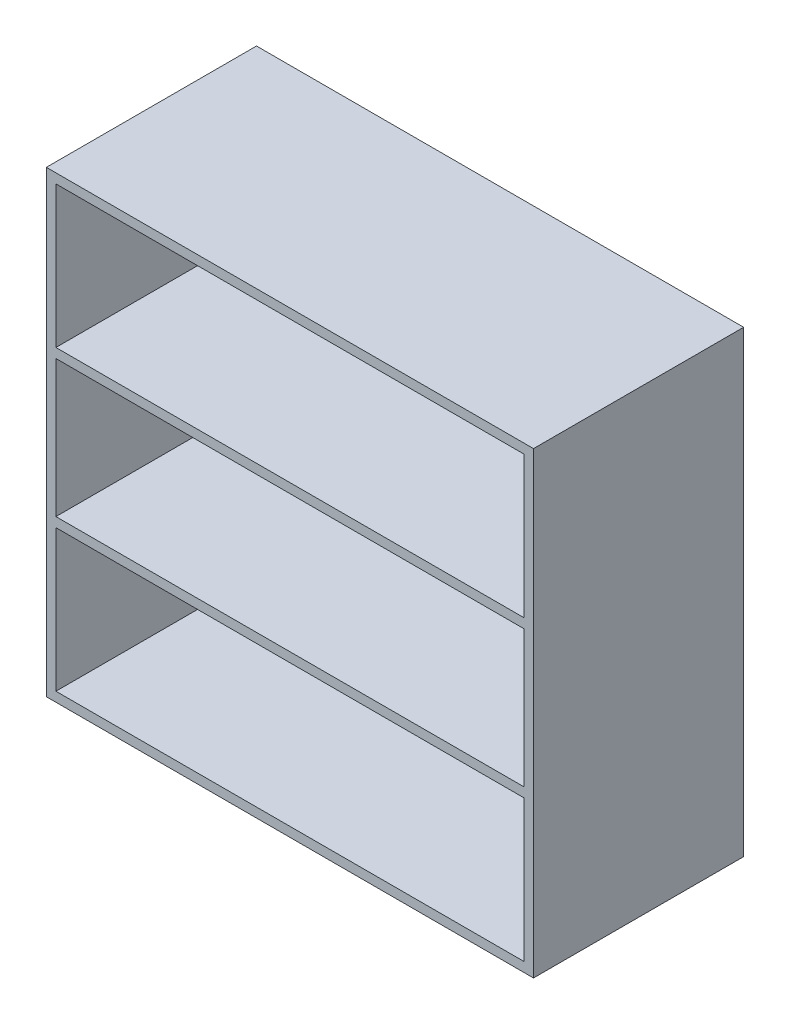
from build123d import *

# Parameters (mm, degrees)
SKETCH1_W           = 2590.8
SKETCH1_H           = 1117.6
BOSS_EXTRUDE1_DEPTH = 2438.4
SKETCH2_W           = 2489.2
SKETCH2_H           = 753.533333333
SKETCH2_H_2         = 728.133333334
CUT_EXTRUDE1_DEPTH  = 2979.738907659


with BuildPart() as part:
    # Sketch1 → Boss-Extrude1 (new body)
    with BuildSketch(Plane(origin=(0, 0, 0), x_dir=(1, 0, 0), z_dir=(0, 1, 0))):
        Rectangle(SKETCH1_W, SKETCH1_H)
    extrude(amount=BOSS_EXTRUDE1_DEPTH)

    # Sketch2 → Cut-Extrude1 (cut, through all)
    with BuildSketch(Plane.XY.offset(558.8)):
        with Locations((0, 427.566666666)):
            Rectangle(SKETCH2_W, SKETCH2_H)
        with Locations((0, 2010.833333334)):
            Rectangle(SKETCH2_W, SKETCH2_H)
        with Locations((0, 1219.2)):
            Rectangle(SKETCH2_W, SKETCH2_H_2)
    extrude(amount=-CUT_EXTRUDE1_DEPTH, mode=Mode.SUBTRACT)


solid = part.part
